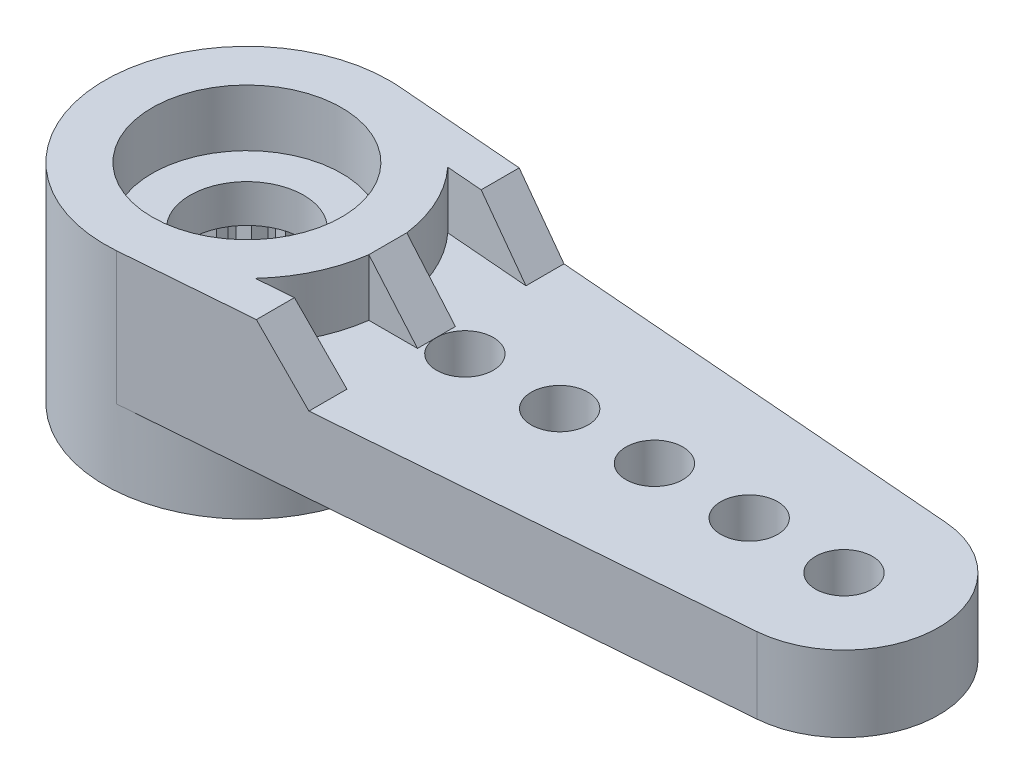
from build123d import *
from build123d.topology import SkipClean

# Parameters (mm, degrees)
ESBO_O1_R                  = 0.75
ESBO_O1_R_2                = 1.5
RESSALTO_EXTRUS_O1_DEPTH   = 2
ESBO_O3_R                  = 3.75
ESBO_O3_R_2                = 2.5
RESSALTO_EXTRUS_O2_DEPTH   = 1.5
RESSALTO_EXTRUS_O3_DEPTH   = 1.5
CORTE_EXTRUS_O1_DEPTH      = 19.95718861
CORTE_EXTRUS_O1_DEPTH_BACK = 19.95718861
RESSALTO_EXTRUS_O4_START   = 2
ESBO_O7_R                  = 3.75
ESBO_O7_R_2                = 1.5
RESSALTO_EXTRUS_O4_DEPTH   = 2
ESBO_O8_R                  = 2.5
CORTE_EXTRUS_O2_DEPTH      = 3
RESSALTO_EXTRUS_O5_START   = 3
RESSALTO_EXTRUS_O5_DEPTH   = 3


with BuildPart() as part:
    # Esboço1 → Ressalto-extrusão1 (new body)
    with BuildSketch(Plane(origin=(0, 0, 0), x_dir=(1, 0, 0), z_dir=(0, 1, 0))):
        with BuildLine():
            Line((0.297619048, 3.738171064), (15.948412698, 2.492114043))
            ThreePointArc((15.948412698, 2.492114043), (18.25, 0), (15.948412698, -2.492114043))
            Line((15.948412698, -2.492114043), (0.297619048, -3.738171064))
            ThreePointArc((0.297619048, -3.738171064), (-3.75, 0), (0.297619048, 3.738171064))
        make_face()
        with Locations(Location((15.75, 0, 0), (0, 0, 270))):
            Circle(ESBO_O1_R, mode=Mode.SUBTRACT)
        with Locations(Location((0, 0, 0), (0, 0, 270))):
            Circle(ESBO_O1_R_2, mode=Mode.SUBTRACT)
        with Locations(Location((13.25, 0, 0), (0, 0, 270))):
            Circle(ESBO_O1_R, mode=Mode.SUBTRACT)
        with Locations(Location((10.75, 0, 0), (0, 0, 270))):
            Circle(ESBO_O1_R, mode=Mode.SUBTRACT)
        with Locations(Location((8.25, 0, 0), (0, 0, 270))):
            Circle(ESBO_O1_R, mode=Mode.SUBTRACT)
        with Locations(Location((5.75, 0, 0), (0, 0, 270))):
            Circle(ESBO_O1_R, mode=Mode.SUBTRACT)
    extrude(amount=RESSALTO_EXTRUS_O1_DEPTH)

    # Esboço3 → Ressalto-extrusão2 (add)
    with SkipClean():  # the faces are left unmerged after this step: merging them gives an invalid solid
        with BuildSketch(Plane(origin=(0, 2, 0), x_dir=(1, 0, 0), z_dir=(0, 1, 0))):
            with Locations(Location((0, 0, 0), (0, 0, 85.447928579))):
                Circle(ESBO_O3_R)
            with Locations(Location((0, 0, 0), (0, 0, 270))):
                Circle(ESBO_O3_R_2, mode=Mode.SUBTRACT)
        extrude(amount=RESSALTO_EXTRUS_O2_DEPTH)

    # Esboço5 → Ressalto-extrusão3 (add)
    with SkipClean():  # the faces are left unmerged after this step: merging them gives an invalid solid
        with BuildSketch(Plane(origin=(0, 2, 0), x_dir=(1, 0, 0), z_dir=(0, 1, 0))):
            with BuildLine():
                Line((5, 2.360620906), (5, 3.36378527))
                Line((5, 3.36378527), (0.297619048, 3.738171064))
                ThreePointArc((0.297619048, 3.738171064), (1.642055332, 3.37137276), (2.759721595, 2.538983403))
                Line((2.759721595, 2.538983403), (5, 2.360620906))
            make_face()
            with BuildLine():
                Line((5, 0.5), (3.716517187, 0.5))
                ThreePointArc((3.716517187, 0.5), (3.75, 0), (3.716517187, -0.5))
                Line((3.716517187, -0.5), (5, -0.5))
                Line((5, -0.5), (5, 0.5))
            make_face()
            with BuildLine():
                Line((5, -2.360620906), (2.759721595, -2.538983403))
                ThreePointArc((2.759721595, -2.538983403), (1.642055332, -3.37137276), (0.297619048, -3.738171064))
                Line((0.297619048, -3.738171064), (5, -3.36378527))
                Line((5, -3.36378527), (5, -2.360620906))
            make_face()
        extrude(amount=RESSALTO_EXTRUS_O3_DEPTH)

    # Esboço6 → Corte-extrusão1 (cut, two sides: drawn at the far end of the back side and taken through both)
    with SkipClean():  # the faces are left unmerged after this step: merging them gives an invalid solid
        with BuildSketch(Plane.XY.offset(-CORTE_EXTRUS_O1_DEPTH_BACK)):
            Polygon((3.716517187, 3.5), (5, 2), (5, 3.5), align=None)
        extrude(amount=CORTE_EXTRUS_O1_DEPTH + CORTE_EXTRUS_O1_DEPTH_BACK, mode=Mode.SUBTRACT)

    # Esboço7 → Ressalto-extrusão4 (add)
    with SkipClean():  # the faces are left unmerged after this step: merging them gives an invalid solid
        with BuildSketch(Plane.XZ.offset(RESSALTO_EXTRUS_O4_START)):
            with Locations(Location((0, 0, 0), (0, 0, 270))):
                Circle(ESBO_O7_R)
            with Locations(Location((0, 0, 0), (0, 0, 270))):
                Circle(ESBO_O7_R_2, mode=Mode.SUBTRACT)
        extrude(amount=-RESSALTO_EXTRUS_O4_DEPTH)

    # Esboço8 → Corte-extrusão2 (cut)
    with SkipClean():  # the faces are left unmerged after this step: merging them gives an invalid solid
        with BuildSketch(Plane.XZ.offset(2)):
            with Locations(Location((0, 0, 0), (0, 0, 90))):
                Circle(ESBO_O8_R)
        extrude(amount=-CORTE_EXTRUS_O2_DEPTH, mode=Mode.SUBTRACT)

    # Esboço9 → Ressalto-extrusão5 (add)
    with SkipClean():  # the faces are left unmerged after this step: merging them gives an invalid solid
        with BuildSketch(Plane.XZ.offset(-1).offset(RESSALTO_EXTRUS_O5_START)):
            with BuildLine():
                Line((-0.3, 2.481934729), (0, 2.181934729))
                Line((0, 2.181934729), (0.3, 2.481934729))
                ThreePointArc((0.3, 2.481934729), (0, 2.5), (-0.3, 2.481934729))
            make_face()
            with BuildLine():
                Line((0.444891262, 2.460095885), (0.643136552, 2.084997491))
                Line((0.643136552, 2.084997491), (1.018234946, 2.283242781))
                ThreePointArc((1.018234946, 2.283242781), (0.736887936, 2.388932014), (0.444891262, 2.460095885))
            make_face()
            with BuildLine():
                Line((1.150251983, 2.219666726), (1.229127598, 1.802799076))
                Line((1.229127598, 1.802799076), (1.645995248, 1.881674691))
                ThreePointArc((1.645995248, 1.881674691), (1.408300145, 2.065596936), (1.150251983, 2.219666726))
            make_face()
            with BuildLine():
                Line((1.753407768, 1.782010437), (1.705905264, 1.360414052))
                Line((1.705905264, 1.360414052), (2.127501649, 1.312911548))
                ThreePointArc((2.127501649, 1.312911548), (1.954578706, 1.558724505), (1.753407768, 1.782010437))
            make_face()
            with BuildLine():
                Line((2.200765578, 1.186014701), (2.031105761, 0.797150269))
                Line((2.031105761, 0.797150269), (2.419970193, 0.627490452))
                ThreePointArc((2.419970193, 0.627490452), (2.327184372, 0.913352561), (2.200765578, 1.186014701))
            make_face()
            with BuildLine():
                Line((2.452575708, 0.484636354), (2.175833597, 0.163056187))
                Line((2.175833597, 0.163056187), (2.497413764, -0.113685925))
                ThreePointArc((2.497413764, -0.113685925), (2.493009493, 0.186825234), (2.452575708, 0.484636354))
            make_face()
            with BuildLine():
                Line((2.486463724, -0.25980406), (2.12722907, -0.485526154))
                Line((2.12722907, -0.485526154), (2.352951164, -0.844760808))
                ThreePointArc((2.352951164, -0.844760808), (2.43731978, -0.556302335), (2.486463724, -0.25980406))
            make_face()
            with BuildLine():
                Line((2.299418526, -0.981159743), (1.889610905, -1.090967365))
                Line((1.889610905, -1.090967365), (1.999418526, -1.500774986))
                ThreePointArc((1.999418526, -1.500774986), (2.165063509, -1.25), (2.299418526, -0.981159743))
            make_face()
            with BuildLine():
                Line((1.908059901, -1.615335078), (1.484092518, -1.599471337))
                Line((1.484092518, -1.599471337), (1.468228778, -2.02343872))
                ThreePointArc((1.468228778, -2.02343872), (1.700431844, -1.83262968), (1.908059901, -1.615335078))
            make_face()
            with BuildLine():
                Line((1.347161781, -2.105980801), (0.946705999, -1.965855263))
                Line((0.946705999, -1.965855263), (0.80658046, -2.366311045))
                ThreePointArc((0.80658046, -2.366311045), (1.084709348, -2.25242217), (1.347161781, -2.105980801))
            make_face()
            with BuildLine():
                Line((0.666562424, -2.409500889), (0.325200497, -2.157564321))
                Line((0.325200497, -2.157564321), (0.073263929, -2.498926249))
                ThreePointArc((0.073263929, -2.498926249), (0.372605665, -2.472077066), (0.666562424, -2.409500889))
            make_face()
            with BuildLine():
                Line((-0.073263929, -2.498926249), (-0.325200497, -2.157564321))
                Line((-0.325200497, -2.157564321), (-0.666562424, -2.409500889))
                ThreePointArc((-0.666562424, -2.409500889), (-0.372605665, -2.472077066), (-0.073263929, -2.498926249))
            make_face()
            with BuildLine():
                Line((-0.80658046, -2.366311045), (-0.946705999, -1.965855263))
                Line((-0.946705999, -1.965855263), (-1.347161781, -2.105980801))
                ThreePointArc((-1.347161781, -2.105980801), (-1.084709348, -2.25242217), (-0.80658046, -2.366311045))
            make_face()
            with BuildLine():
                Line((-1.468228778, -2.02343872), (-1.484092518, -1.599471337))
                Line((-1.484092518, -1.599471337), (-1.908059901, -1.615335078))
                ThreePointArc((-1.908059901, -1.615335078), (-1.700431844, -1.83262968), (-1.468228778, -2.02343872))
            make_face()
            with BuildLine():
                Line((-1.999418526, -1.500774986), (-1.889610905, -1.090967365))
                Line((-1.889610905, -1.090967365), (-2.299418526, -0.981159743))
                ThreePointArc((-2.299418526, -0.981159743), (-2.165063509, -1.25), (-1.999418526, -1.500774986))
            make_face()
            with BuildLine():
                Line((-2.352951164, -0.844760808), (-2.12722907, -0.485526154))
                Line((-2.12722907, -0.485526154), (-2.486463724, -0.25980406))
                ThreePointArc((-2.486463724, -0.25980406), (-2.43731978, -0.556302335), (-2.352951164, -0.844760808))
            make_face()
            with BuildLine():
                Line((-2.497413764, -0.113685925), (-2.175833597, 0.163056187))
                Line((-2.175833597, 0.163056187), (-2.452575708, 0.484636354))
                ThreePointArc((-2.452575708, 0.484636354), (-2.493009493, 0.186825234), (-2.497413764, -0.113685925))
            make_face()
            with BuildLine():
                Line((-2.419970193, 0.627490452), (-2.031105761, 0.797150269))
                Line((-2.031105761, 0.797150269), (-2.200765578, 1.186014701))
                ThreePointArc((-2.200765578, 1.186014701), (-2.327184372, 0.913352561), (-2.419970193, 0.627490452))
            make_face()
            with BuildLine():
                Line((-2.127501649, 1.312911548), (-1.705905264, 1.360414052))
                Line((-1.705905264, 1.360414052), (-1.753407768, 1.782010437))
                ThreePointArc((-1.753407768, 1.782010437), (-1.954578706, 1.558724505), (-2.127501649, 1.312911548))
            make_face()
            with BuildLine():
                Line((-1.645995248, 1.881674691), (-1.229127598, 1.802799076))
                Line((-1.229127598, 1.802799076), (-1.150251983, 2.219666726))
                ThreePointArc((-1.150251983, 2.219666726), (-1.408300145, 2.065596936), (-1.645995248, 1.881674691))
            make_face()
            with BuildLine():
                Line((-1.018234946, 2.283242781), (-0.643136552, 2.084997491))
                Line((-0.643136552, 2.084997491), (-0.444891262, 2.460095885))
                ThreePointArc((-0.444891262, 2.460095885), (-0.736887936, 2.388932014), (-1.018234946, 2.283242781))
            make_face()
        extrude(amount=-RESSALTO_EXTRUS_O5_DEPTH)


solid = part.part
